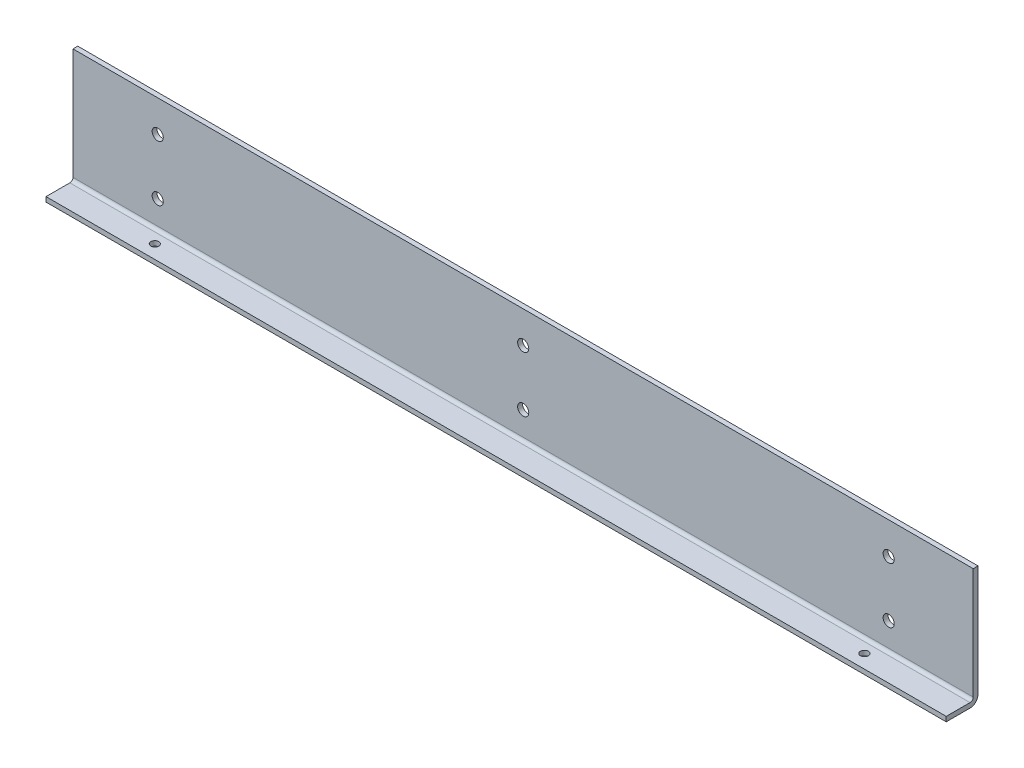
from build123d import *

# Parameters (mm, degrees)
SKETCH_1_W          = 566.5
SKETCH_1_H          = 75
EXTRUDE_1_DEPTH     = 3
SKETCH_2_W          = 566.5
SKETCH_2_H          = 3
EXTRUDE_2_DEPTH     = 17
SKETCH_3_R          = 3.5
CUT_EXTRUDE_1_DEPTH = 572.695941913
SKETCH_4_R          = 2.5
CUT_EXTRUDE_2_DEPTH = 572.407254067
FILLET_2_R          = 2
FILLET_3_R          = 5


with BuildPart() as part:
    # 스케치1 → 보스-돌출1 (new body)
    with BuildSketch(Plane.XY):
        with Locations((283.25, 37.5)):
            Rectangle(SKETCH_1_W, SKETCH_1_H)
    extrude(amount=EXTRUDE_1_DEPTH)

    # 스케치2 → 보스-돌출2 (add)
    with BuildSketch(Plane.XY.offset(3)):
        with Locations((283.25, 1.5)):
            Rectangle(SKETCH_2_W, SKETCH_2_H)
    extrude(amount=EXTRUDE_2_DEPTH)

    # 스케치3 → 컷-돌출1 (cut, through all)
    with BuildSketch(Plane.XY.offset(3)):
        with Locations((53.3, 55)):
            Circle(SKETCH_3_R)
        with Locations((53.3, 20)):
            Circle(SKETCH_3_R)
        with Locations((283.3, 55)):
            Circle(SKETCH_3_R)
        with Locations((283.3, 20)):
            Circle(SKETCH_3_R)
        with Locations((513.3, 55)):
            Circle(SKETCH_3_R)
        with Locations((513.3, 20)):
            Circle(SKETCH_3_R)
    extrude(amount=-CUT_EXTRUDE_1_DEPTH, mode=Mode.SUBTRACT)

    # 스케치4 → 컷-돌출2 (cut, through all)
    with BuildSketch(Plane(origin=(0, 3, 0), x_dir=(1, 0, 0), z_dir=(0, 1, 0))):
        with Locations(Location((60, -11.5, 0), (0, 0, 270))):
            Circle(SKETCH_4_R)
        with Locations(Location((506.5, -11.5, 0), (0, 0, 270))):
            Circle(SKETCH_4_R)
    extrude(amount=-CUT_EXTRUDE_2_DEPTH, mode=Mode.SUBTRACT)

    # 필렛2
    fillet_2_edges = [part.edges().sort_by_distance(p)[0] for p in [
        (283.25, 3, 3),
    ]]
    fillet(fillet_2_edges, radius=FILLET_2_R)

    # 필렛3
    fillet_3_edges = [part.edges().sort_by_distance(p)[0] for p in [
        (283.25, 0, 0),
    ]]
    fillet(fillet_3_edges, radius=FILLET_3_R)


solid = part.part
